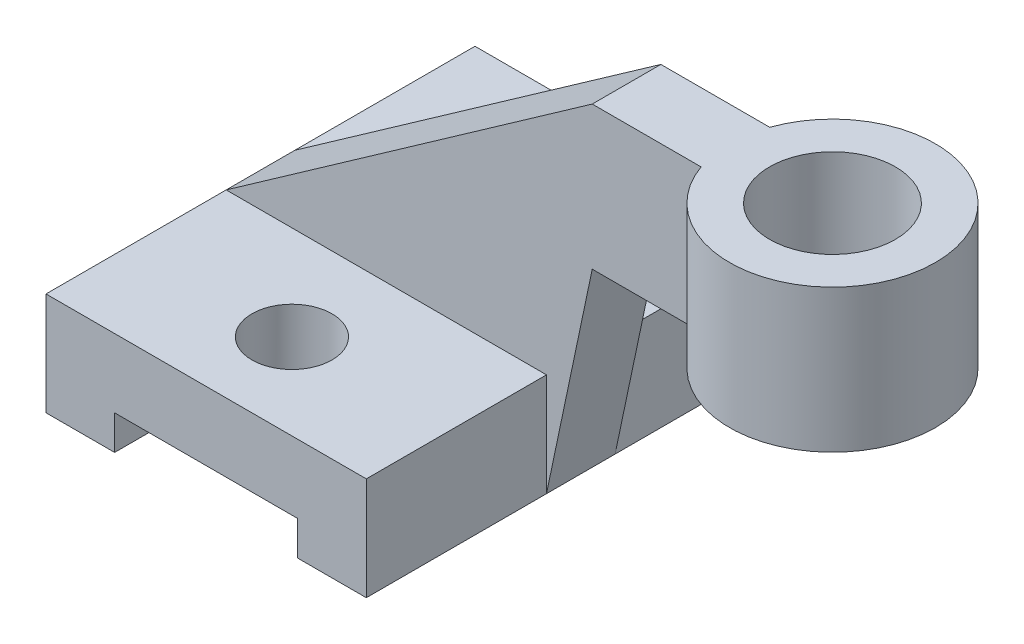
from build123d import *

# Parameters (mm, degrees)
BOSS_EXTRUDE1_DEPTH    = 75
SKETCH9_R              = 11
BOSS_EXTRUDE3_DEPTH    = 25
BOSS_EXTRUDE4_DEPTH    = 6
F_12_0MM_DOWEL_HOLE1_D = 14


with BuildPart() as part:
    # Sketch1 → Boss-Extrude1 (new body)
    with BuildSketch(Plane.XY):
        Polygon((-16, -9), (-16, -3), (16, -3), (16, -9), (28, -9), (28, 9), (-28, 9), (-28, -9), align=None)
    extrude(amount=-BOSS_EXTRUDE1_DEPTH)



with BuildPart() as body_2:
    # Sketch9 → Boss-Extrude3 (new body)
    with BuildSketch(Plane(origin=(0, 54, 0), x_dir=(-1, 0, 0), z_dir=(0, -1, 0))):
        with BuildLine():
            Line((-55.029437252, 43.5), (-36, 43.5))
            Line((-36, 43.5), (-36, 31.5))
            Line((-36, 31.5), (-55.029437252, 31.5))
            ThreePointArc((-55.029437252, 31.5), (-90, 37.5), (-55.029437252, 43.5))
        make_face()
        with Locations(Location((-72, 37.5, 0), (0, 0, 180))):
            Circle(SKETCH9_R, mode=Mode.SUBTRACT)
    extrude(amount=BOSS_EXTRUDE3_DEPTH)


with BuildPart() as part_1:
    add(part.part)

    add(body_2.part)  # Boss-Extrude4 merges body 2
    # Sketch11 → Boss-Extrude4 (add, symmetric)
    with BuildSketch(Plane.XY.offset(-37.5)):
        Polygon((36, 29), (28, -9), (28, 9), (-28, 9), (36, 54), align=None)
    extrude(amount=BOSS_EXTRUDE4_DEPTH, both=True)

    # Ø12.0mm Dowel Hole1 (through all)
    with Locations(Plane(origin=(0, 9, 0), x_dir=(1, 0, 0), z_dir=(0, 1, 0))):
        with Locations((0, 15), (0, 60)):
            Hole(F_12_0MM_DOWEL_HOLE1_D / 2)


solid = part_1.part
